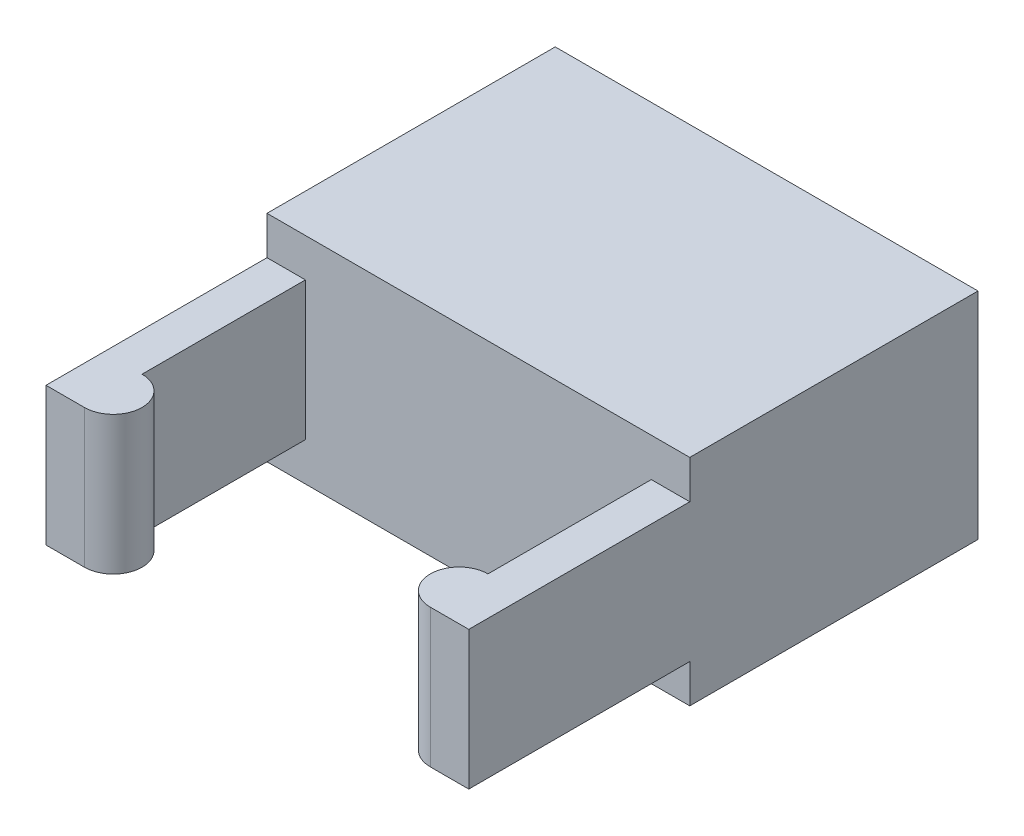
from build123d import *

# Parameters (mm, degrees)
SKETCH1_W           = 2
SKETCH1_H           = 7.2
SKETCH1_W_2         = 18
BOSS_EXTRUDE3_DEPTH = 15
BOSS_EXTRUDE4_START = 15
SKETCH1_4_W         = 2
SKETCH1_4_H         = 7.2
BOSS_EXTRUDE4_DEPTH = 8.5
BOSS_EXTRUDE5_START = -3.6
SKETCH3_W           = 2
SKETCH3_H           = 3
BOSS_EXTRUDE5_DEPTH = 7.2


with BuildPart() as part:
    # Sketch1 → Boss-Extrude3 (new body)
    with BuildSketch(Plane.XY):
        Polygon((9, 3.6), (11, 3.6), (11, 5.6), (-11, 5.6), (-11, 3.6), (-9, 3.6), align=None)
        with Locations((-10, 0)):
            Rectangle(SKETCH1_W, SKETCH1_H)
        Rectangle(SKETCH1_W_2, SKETCH1_H)
        Polygon((11, -3.6), (11, -5.6), (-11, -5.6), (-11, -3.6), (-9, -3.6), (9, -3.6), align=None)
        with Locations((10, 0)):
            Rectangle(SKETCH1_W, SKETCH1_H)
    extrude(amount=BOSS_EXTRUDE3_DEPTH)

    # Sketch1<4> → Boss-Extrude4 (add)
    with BuildSketch(Plane.XY.offset(BOSS_EXTRUDE4_START)):
        with Locations((-10, 0)):
            Rectangle(SKETCH1_4_W, SKETCH1_4_H)
        with Locations((10, 0)):
            Rectangle(SKETCH1_4_W, SKETCH1_4_H)
    extrude(amount=BOSS_EXTRUDE4_DEPTH)

    # Sketch3 → Boss-Extrude5 (add)
    with BuildSketch(Plane(origin=(0, 0, 0), x_dir=(1, 0, 0), z_dir=(0, 1, 0)).offset(BOSS_EXTRUDE5_START)):
        with Locations((-10, -25)):
            Rectangle(SKETCH3_W, SKETCH3_H)
        with BuildLine():
            Line((-9, -23.5), (-9, -26.5))
            ThreePointArc((-9, -26.5), (-7.5, -25), (-9, -23.5))
        make_face()
    boss_extrude5 = extrude(amount=BOSS_EXTRUDE5_DEPTH)

    # Mirror1: Boss-Extrude5 across plane
    add(boss_extrude5.mirror(Plane(origin=(0, 0, 0), x_dir=(0, 0, 1), z_dir=(1, 0, 0))))


solid = part.part
